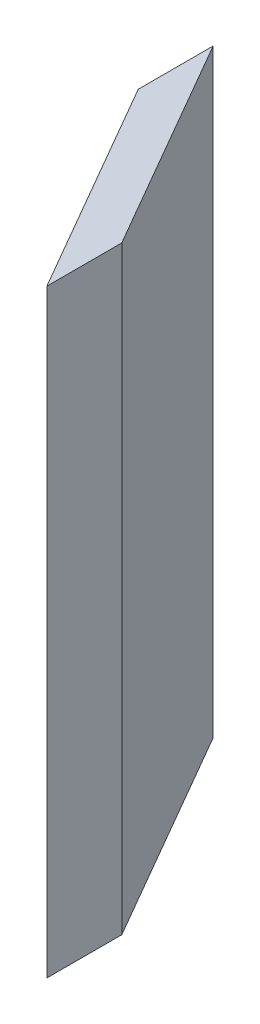
from build123d import *

# Parameters (mm, degrees)
EXTRUDE_1_DEPTH = 120


with BuildPart() as part:
    # 草图1 → 凸台-拉伸1 (new body)
    with BuildSketch(Plane(origin=(0, 0, 0), x_dir=(1, 0, 0), z_dir=(0, 1, 0))):
        Polygon((0, 0), (0, -15), (25, -58.301270189), (25, -43.301270189), align=None)
    extrude(amount=EXTRUDE_1_DEPTH)


solid = part.part
